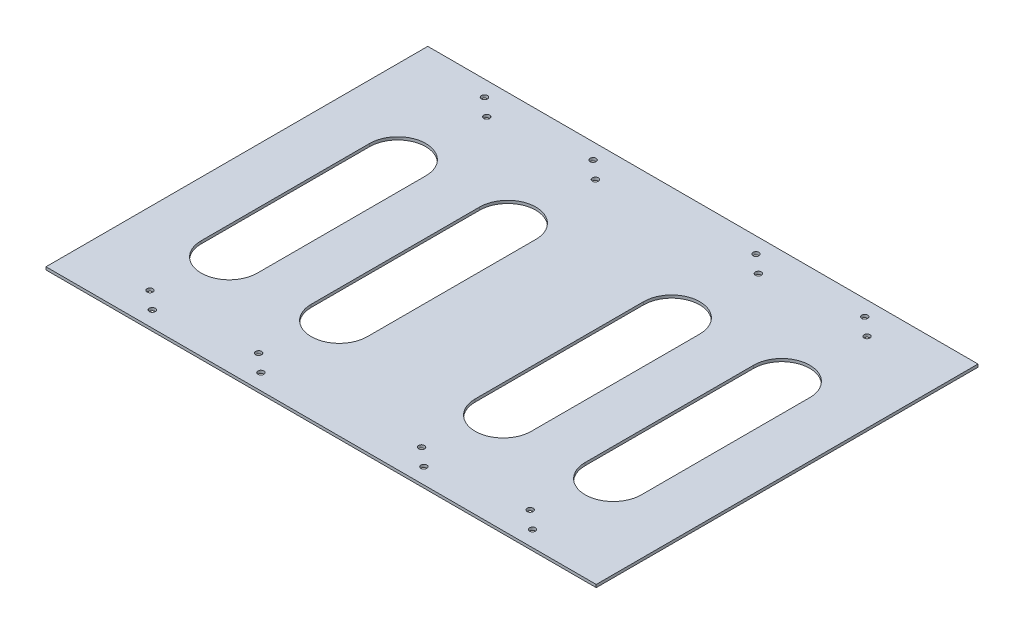
from build123d import *

# Parameters (mm, degrees)
SKETCH1_W                 = 392
SKETCH1_H                 = 272
BOSS_EXTRUDE1_DEPTH       = 2
CUT_EXTRUDE1_REACH        = 240.571
SKETCH2_R                 = 2.125
LPATTERN1_COUNT           = 2
LPATTERN1_PITCH           = 77.4
LPATTERN7_COUNT           = 2
LPATTERN7_PITCH           = 193.5
LPATTERN7_COPY_1_REACH    = 240.571
LPATTERN7_COPY_1_SKETCH_R = 2.125
CUT_EXTRUDE2_DEPTH        = 239.570744225


with BuildPart() as part:
    # Sketch1 → Boss-Extrude1 (new body)
    with BuildSketch(Plane(origin=(0, 0, 0), x_dir=(1, 0, 0), z_dir=(0, 1, 0))):
        Rectangle(SKETCH1_W, SKETCH1_H)
    extrude(amount=BOSS_EXTRUDE1_DEPTH)

    # Sketch2 → Cut-Extrude1 (cut, up to next)
    with BuildSketch(Plane(origin=(0, 2, 0), x_dir=(1, 0, 0), z_dir=(0, 1, 0)), mode=Mode.PRIVATE) as cut_extrude1_sk1:
        with Locations(Location((139.4, -124.77, 0), (0, 0, 270))):
            Circle(SKETCH2_R)
    cut_extrude1_tool1 = extrude(cut_extrude1_sk1.sketch, amount=-CUT_EXTRUDE1_REACH, mode=Mode.PRIVATE) & part.part
    # Sketch2 → Cut-Extrude1 (cut, up to next)
    with BuildSketch(Plane(origin=(0, 2, 0), x_dir=(1, 0, 0), z_dir=(0, 1, 0)), mode=Mode.PRIVATE) as cut_extrude1_sk2:
        with Locations(Location((126.5, -113.53, 0), (0, 0, 270))):
            Circle(SKETCH2_R)
    cut_extrude1_tool2 = extrude(cut_extrude1_sk2.sketch, amount=-CUT_EXTRUDE1_REACH, mode=Mode.PRIVATE) & part.part
    # Sketch2 → Cut-Extrude1 (cut, up to next)
    with BuildSketch(Plane(origin=(0, 2, 0), x_dir=(1, 0, 0), z_dir=(0, 1, 0)), mode=Mode.PRIVATE) as cut_extrude1_sk3:
        with Locations(Location((126.5, 124.77, 0), (0, 0, 270))):
            Circle(SKETCH2_R)
    cut_extrude1_tool3 = extrude(cut_extrude1_sk3.sketch, amount=-CUT_EXTRUDE1_REACH, mode=Mode.PRIVATE) & part.part
    # Sketch2 → Cut-Extrude1 (cut, up to next)
    with BuildSketch(Plane(origin=(0, 2, 0), x_dir=(1, 0, 0), z_dir=(0, 1, 0)), mode=Mode.PRIVATE) as cut_extrude1_sk4:
        with Locations(Location((139.4, 113.53, 0), (0, 0, 270))):
            Circle(SKETCH2_R)
    cut_extrude1_tool4 = extrude(cut_extrude1_sk4.sketch, amount=-CUT_EXTRUDE1_REACH, mode=Mode.PRIVATE) & part.part
    cut_extrude1_1 = cut_extrude1_tool1.solids().sort_by_distance((139.4, 2, 124.77))[0]
    add(cut_extrude1_1, mode=Mode.SUBTRACT)
    cut_extrude1_2 = cut_extrude1_tool2.solids().sort_by_distance((126.5, 2, 113.53))[0]
    add(cut_extrude1_2, mode=Mode.SUBTRACT)
    cut_extrude1_3 = cut_extrude1_tool3.solids().sort_by_distance((126.5, 2, -124.77))[0]
    add(cut_extrude1_3, mode=Mode.SUBTRACT)
    cut_extrude1_4 = cut_extrude1_tool4.solids().sort_by_distance((139.4, 2, -113.53))[0]
    add(cut_extrude1_4, mode=Mode.SUBTRACT)
    cut_extrude1 = cut_extrude1_1 + cut_extrude1_2 + cut_extrude1_3 + cut_extrude1_4  # Cut-Extrude1 as one shape, for the pattern or mirror that repeats it

    # LPattern1: Cut-Extrude1 ×2
    with Locations(*[(-i * LPATTERN1_PITCH, 0, 0) for i in range(1, LPATTERN1_COUNT)]):
        add(cut_extrude1, mode=Mode.SUBTRACT)

    # LPattern7: Cut-Extrude1 ×2
    with Locations(*[(-i * LPATTERN7_PITCH, 0, 0) for i in range(1, LPATTERN7_COUNT)]):
        add(cut_extrude1, mode=Mode.SUBTRACT)

    # LPattern7 copy 1 sketch → LPattern7 copy 1 (cut, up to next)
    with BuildSketch(Plane(origin=(-270.9, 2, 0), x_dir=(1, 0, 0), z_dir=(0, 1, 0)), mode=Mode.PRIVATE) as lpattern7_copy_1_sk1:
        with Locations(Location((139.4, -124.77, 0), (0, 0, 270))):
            Circle(LPATTERN7_COPY_1_SKETCH_R)
    lpattern7_copy_1_tool1 = extrude(lpattern7_copy_1_sk1.sketch, amount=-LPATTERN7_COPY_1_REACH, mode=Mode.PRIVATE) & part.part
    # LPattern7 copy 1 sketch → LPattern7 copy 1 (cut, up to next)
    with BuildSketch(Plane(origin=(-270.9, 2, 0), x_dir=(1, 0, 0), z_dir=(0, 1, 0)), mode=Mode.PRIVATE) as lpattern7_copy_1_sk2:
        with Locations(Location((126.5, -113.53, 0), (0, 0, 270))):
            Circle(LPATTERN7_COPY_1_SKETCH_R)
    lpattern7_copy_1_tool2 = extrude(lpattern7_copy_1_sk2.sketch, amount=-LPATTERN7_COPY_1_REACH, mode=Mode.PRIVATE) & part.part
    # LPattern7 copy 1 sketch → LPattern7 copy 1 (cut, up to next)
    with BuildSketch(Plane(origin=(-270.9, 2, 0), x_dir=(1, 0, 0), z_dir=(0, 1, 0)), mode=Mode.PRIVATE) as lpattern7_copy_1_sk3:
        with Locations(Location((126.5, 124.77, 0), (0, 0, 270))):
            Circle(LPATTERN7_COPY_1_SKETCH_R)
    lpattern7_copy_1_tool3 = extrude(lpattern7_copy_1_sk3.sketch, amount=-LPATTERN7_COPY_1_REACH, mode=Mode.PRIVATE) & part.part
    # LPattern7 copy 1 sketch → LPattern7 copy 1 (cut, up to next)
    with BuildSketch(Plane(origin=(-270.9, 2, 0), x_dir=(1, 0, 0), z_dir=(0, 1, 0)), mode=Mode.PRIVATE) as lpattern7_copy_1_sk4:
        with Locations(Location((139.4, 113.53, 0), (0, 0, 270))):
            Circle(LPATTERN7_COPY_1_SKETCH_R)
    lpattern7_copy_1_tool4 = extrude(lpattern7_copy_1_sk4.sketch, amount=-LPATTERN7_COPY_1_REACH, mode=Mode.PRIVATE) & part.part
    add(lpattern7_copy_1_tool1.solids().sort_by_distance((-131.5, 2, 124.77))[0], mode=Mode.SUBTRACT)
    add(lpattern7_copy_1_tool2.solids().sort_by_distance((-144.4, 2, 113.53))[0], mode=Mode.SUBTRACT)
    add(lpattern7_copy_1_tool3.solids().sort_by_distance((-144.4, 2, -124.77))[0], mode=Mode.SUBTRACT)
    add(lpattern7_copy_1_tool4.solids().sort_by_distance((-131.5, 2, -113.53))[0], mode=Mode.SUBTRACT)

    # Sketch3 → Cut-Extrude2 (cut, through all)
    with BuildSketch(Plane(origin=(0, 2, 0), x_dir=(1, 0, 0), z_dir=(0, 1, 0))):
        with BuildLine():
            Line((-116.8, 55.364791438), (-116.8, -64.635208562))
            ThreePointArc((-116.8, -64.635208562), (-136.8, -84.635208562), (-156.8, -64.635208562))
            Line((-156.8, -64.635208562), (-156.8, 55.364791438))
            ThreePointArc((-156.8, 55.364791438), (-136.8, 75.364791438), (-116.8, 55.364791438))
        make_face()
        with BuildLine():
            Line((-38.4, 55.364791438), (-38.4, -64.635208562))
            ThreePointArc((-38.4, -64.635208562), (-58.4, -84.635208562), (-78.4, -64.635208562))
            Line((-78.4, -64.635208562), (-78.4, 55.364791438))
            ThreePointArc((-78.4, 55.364791438), (-58.4, 75.364791438), (-38.4, 55.364791438))
        make_face()
        with BuildLine():
            Line((38.4, 55.364791438), (38.4, -64.635208562))
            ThreePointArc((38.4, -64.635208562), (58.4, -84.635208562), (78.4, -64.635208562))
            Line((78.4, -64.635208562), (78.4, 55.364791438))
            ThreePointArc((78.4, 55.364791438), (58.4, 75.364791438), (38.4, 55.364791438))
        make_face()
        with BuildLine():
            Line((116.8, 55.364791438), (116.8, -64.635208562))
            ThreePointArc((116.8, -64.635208562), (136.8, -84.635208562), (156.8, -64.635208562))
            Line((156.8, -64.635208562), (156.8, 55.364791438))
            ThreePointArc((156.8, 55.364791438), (136.8, 75.364791438), (116.8, 55.364791438))
        make_face()
    extrude(amount=-CUT_EXTRUDE2_DEPTH, mode=Mode.SUBTRACT)


solid = part.part
